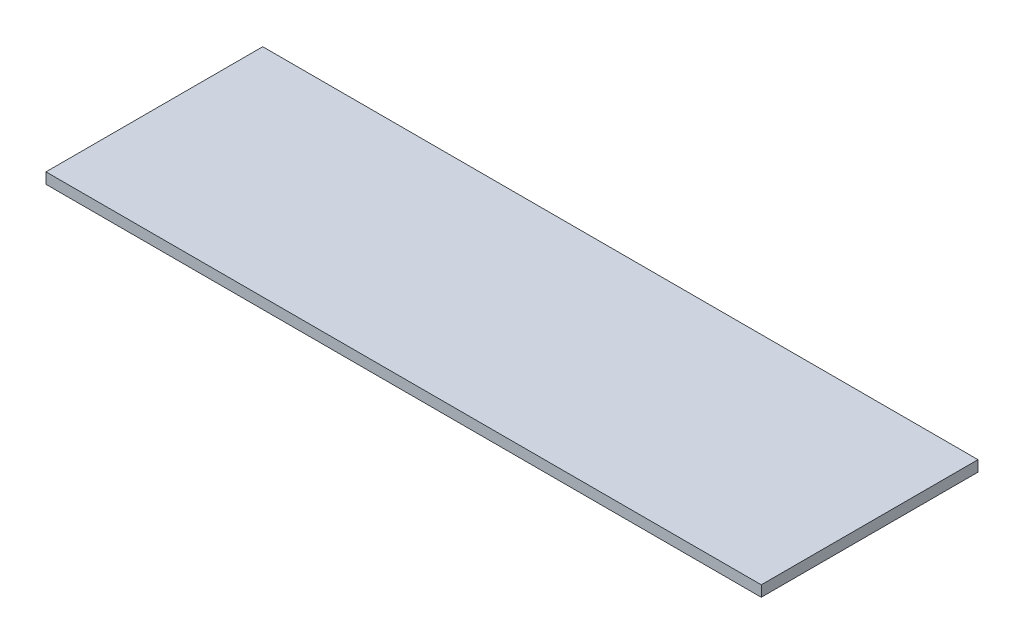
from build123d import *

# Parameters (mm, degrees)
CROQUIS1_W              = 1188
CROQUIS1_H              = 360
SALIENTE_EXTRUIR1_DEPTH = 18


with BuildPart() as part:
    # Croquis1 → Saliente-Extruir1 (new body)
    with BuildSketch(Plane(origin=(0, 0, 0), x_dir=(1, 0, 0), z_dir=(0, 1, 0))):
        Rectangle(CROQUIS1_W, CROQUIS1_H)
    extrude(amount=SALIENTE_EXTRUIR1_DEPTH)


solid = part.part
